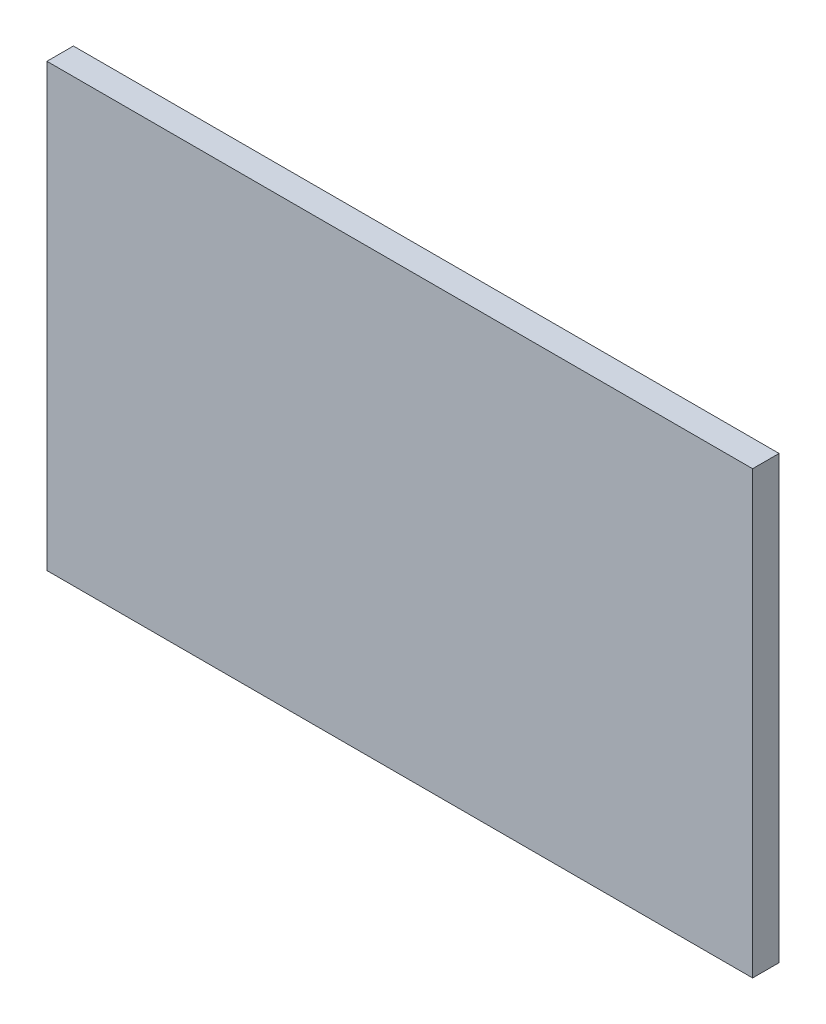
from build123d import *

# Parameters (mm, degrees)
SKETCH1_W           = 80
SKETCH1_H           = 50
BOSS_EXTRUDE1_DEPTH = 3


with BuildPart() as part:
    # Sketch1 → Boss-Extrude1 (new body)
    with BuildSketch(Plane.XY):
        Rectangle(SKETCH1_W, SKETCH1_H)
    extrude(amount=BOSS_EXTRUDE1_DEPTH)


solid = part.part
